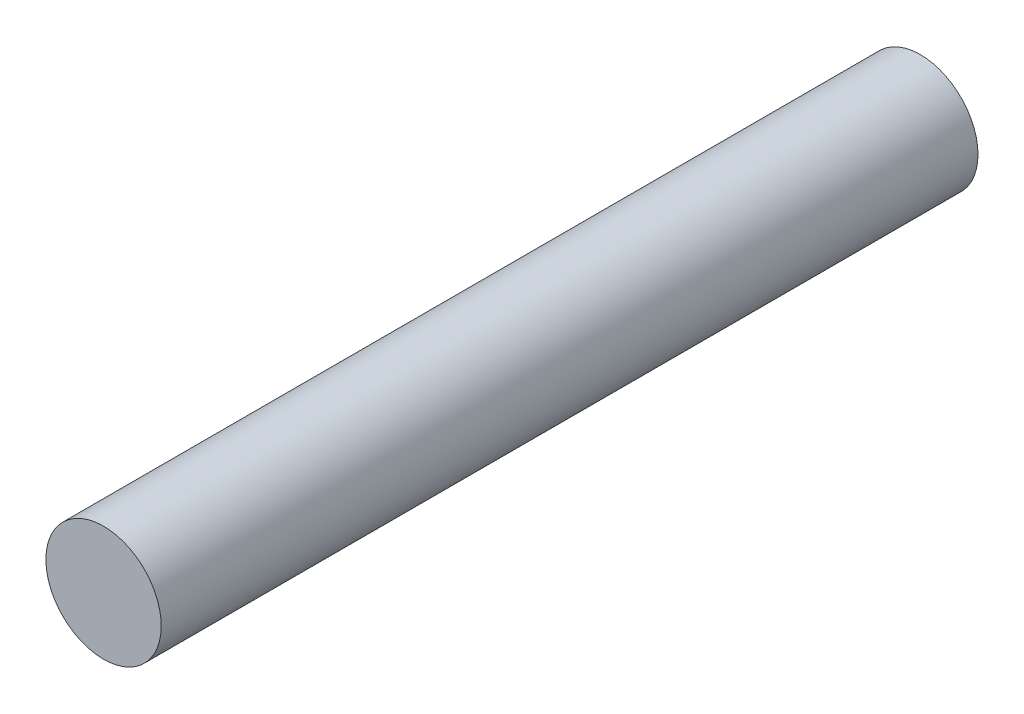
from build123d import *

# Parameters (mm, degrees)
CROQUIS1_R              = 6
SALIENTE_EXTRUIR1_DEPTH = 85


with BuildPart() as part:
    # Croquis1 → Saliente-Extruir1 (new body)
    with BuildSketch(Plane.XY):
        Circle(CROQUIS1_R)
    extrude(amount=SALIENTE_EXTRUIR1_DEPTH)


solid = part.part
